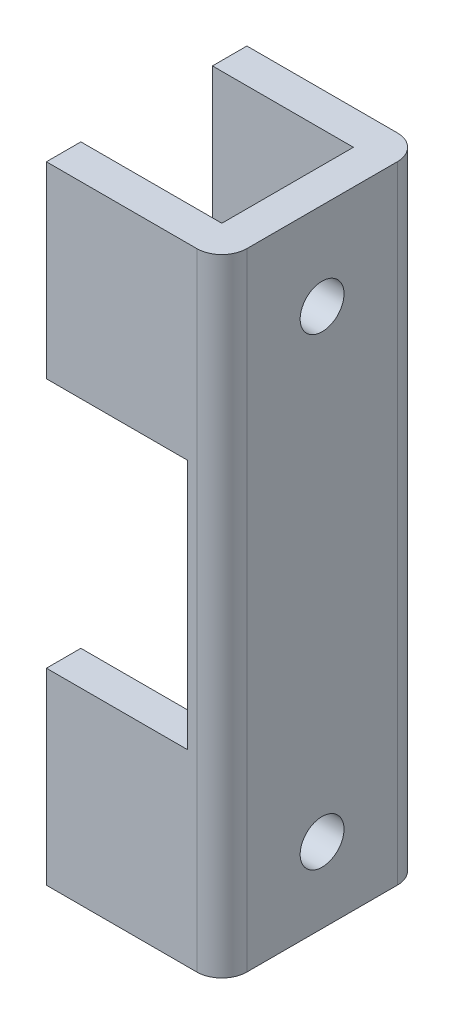
from build123d import *

# Parameters (mm, degrees)
EXTRUDE_1_DEPTH     = 50
SKETCH_2_W          = 8.5
SKETCH_2_H          = 10.5
CUT_EXTRUDE_1_DEPTH = 52.870829554
SKETCH_3_W          = 2.75
SKETCH_3_H          = 10.5
CUT_EXTRUDE_2_DEPTH = 52.870829554
SKETCH_4_R          = 1.75
CUT_EXTRUDE_3_DEPTH = 53.975575482
SKETCH_6_W          = 11.25
SKETCH_6_H          = 20
CUT_EXTRUDE_4_DEPTH = 54.255716697


with BuildPart() as part:
    # 草图1 → 凸台-拉伸1 (new body)
    with BuildSketch(Plane(origin=(0, 0, 0), x_dir=(1, 0, 0), z_dir=(0, 1, 0))):
        with BuildLine():
            Line((-8.953846154, 10.507692308), (-8.953846154, -5.492307692))
            Line((-8.953846154, -5.492307692), (3.046153846, -5.492307692))
            ThreePointArc((3.046153846, -5.492307692), (4.460367409, -4.906521255), (5.046153846, -3.492307692))
            Line((5.046153846, -3.492307692), (5.046153846, 8.507692308))
            ThreePointArc((5.046153846, 8.507692308), (4.460367409, 9.92190587), (3.046153846, 10.507692308))
            Line((3.046153846, 10.507692308), (-8.953846154, 10.507692308))
        make_face()
    extrude(amount=EXTRUDE_1_DEPTH)

    # 草图2 → 切除-拉伸1 (cut, through all)
    with BuildSketch(Plane(origin=(0, 50, 0), x_dir=(1, 0, 0), z_dir=(0, 1, 0))):
        with Locations((-1.953846154, 2.507692308)):
            Rectangle(SKETCH_2_W, SKETCH_2_H)
    extrude(amount=-CUT_EXTRUDE_1_DEPTH, mode=Mode.SUBTRACT)

    # 草图3 → 切除-拉伸2 (cut, through all)
    with BuildSketch(Plane(origin=(0, 50, 0), x_dir=(1, 0, 0), z_dir=(0, 1, 0))):
        with Locations((-7.578846154, 2.507692308)):
            Rectangle(SKETCH_3_W, SKETCH_3_H)
    extrude(amount=-CUT_EXTRUDE_2_DEPTH, mode=Mode.SUBTRACT)

    # 草图4 → 切除-拉伸3 (cut, through all)
    with BuildSketch(Plane(origin=(5.046153846, 0, 0), x_dir=(0, 0, -1), z_dir=(1, 0, 0))):
        with Locations((2.507692308, 43)):
            Circle(SKETCH_4_R)
        with Locations((2.507692308, 6)):
            Circle(SKETCH_4_R)
    extrude(amount=-CUT_EXTRUDE_3_DEPTH, mode=Mode.SUBTRACT)

    # 草图6 → 切除-拉伸4 (cut, through all)
    with BuildSketch(Plane(origin=(0, 0, -10.507692308), x_dir=(-1, 0, 0), z_dir=(0, 0, -1))):
        with Locations((3.328846154, 25)):
            Rectangle(SKETCH_6_W, SKETCH_6_H)
    extrude(amount=-CUT_EXTRUDE_4_DEPTH, mode=Mode.SUBTRACT)


solid = part.part
